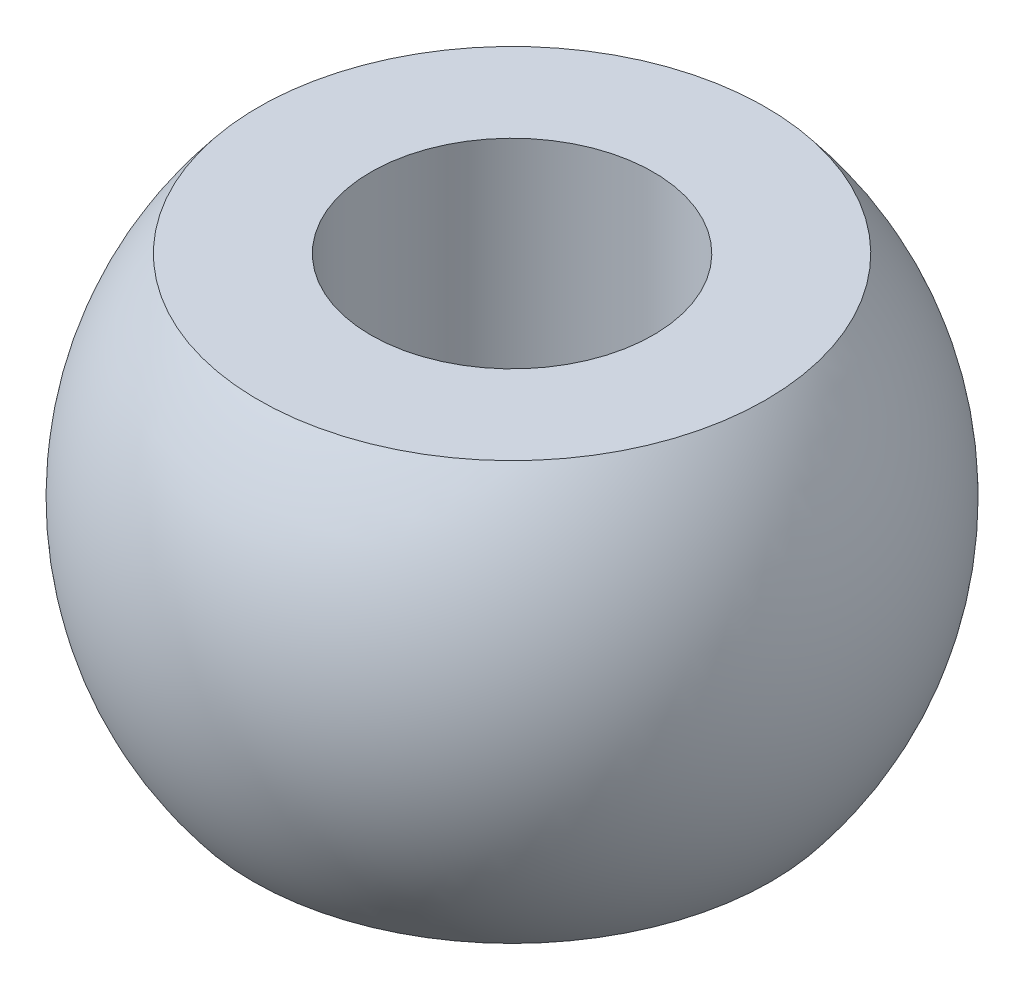
from build123d import *


with BuildPart() as part:
    # Sketch1 → Revolve1 (revolve)
    with BuildSketch(Plane.XY, mode=Mode.PRIVATE) as revolve1_sk:
        with BuildLine():
            Line((1.5, 2.234936491), (1.5, -0.365063509))
            Line((1.5, -0.365063509), (2.25, -0.365063509))
            Line((2.25, -0.365063509), (2.25, -2.165063509))
            Line((2.25, -2.165063509), (2.75, -2.165063509))
            ThreePointArc((2.75, -2.165063509), (3.499711701, 0.044922259), (2.693521651, 2.234936491))
            Line((2.693521651, 2.234936491), (1.5, 2.234936491))
        make_face()
    revolve(revolve1_sk.sketch.rotate(Axis((0, 2.941029024, 0), (0, -1, 0)), 90), axis=Axis((0, 2.941029024, 0), (0, -1, 0)))


solid = part.part
